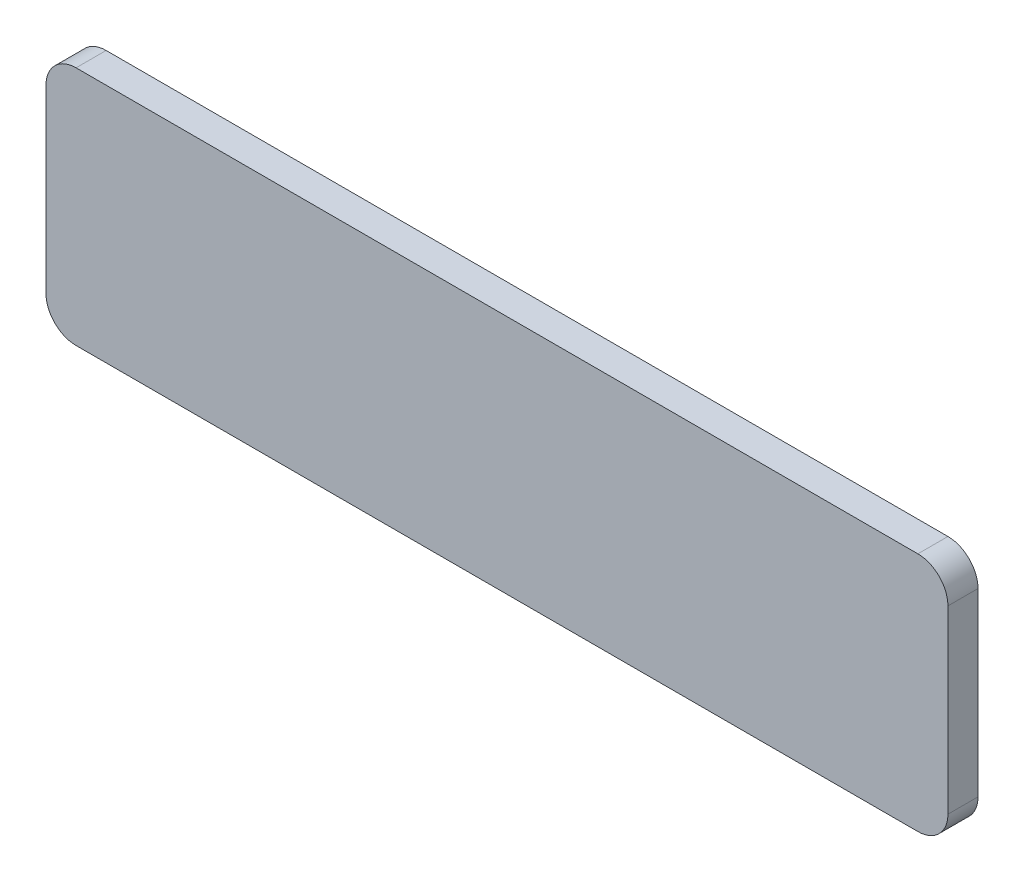
from build123d import *

# Parameters (mm, degrees)
EXTRUDE_1_DEPTH = 1


with BuildPart() as part:
    # 草图1 → 凸台-拉伸1 (new body)
    with BuildSketch(Plane.XY):
        with BuildLine():
            Line((1, 0), (29, 0))
            ThreePointArc((29, 0), (29.707106781, 0.292893219), (30, 1))
            Line((30, 1), (30, 7))
            ThreePointArc((30, 7), (29.707106781, 7.707106781), (29, 8))
            Line((29, 8), (1, 8))
            ThreePointArc((1, 8), (0.292893219, 7.707106781), (0, 7))
            Line((0, 7), (0, 1))
            ThreePointArc((0, 1), (0.292893219, 0.292893219), (1, 0))
        make_face()
    extrude(amount=EXTRUDE_1_DEPTH)


solid = part.part
